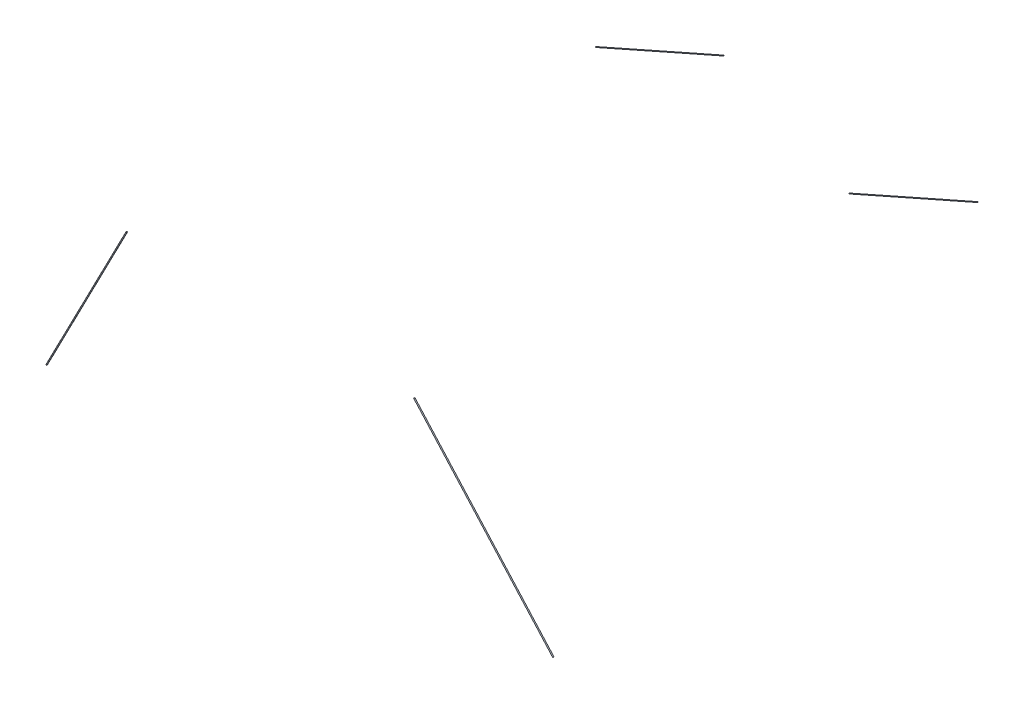
from build123d import *

# Parameters (mm, degrees)
SWEEP1_PROFILE_R = 0.79375
SWEEP2_PROFILE_R = 1.190625


with BuildPart() as part:
    # Sweep1: sweep along a curve in space
    with BuildLine() as sweep1_path:
        Line((285.474604576, 350.615166874, -782.773583612), (285.474604576, 189.720208784, -1071.122074957))
    # Sweep1 profile (on start of the path) → Sweep1 (sweep)
    with BuildSketch(Plane(origin=(285.474604576, 350.615166874, -782.773583612), x_dir=(0, -0.8732540622216938, 0.4872651668376371), z_dir=(0, -0.4872651668376371, -0.8732540622216938))):
        Circle(SWEEP1_PROFILE_R)
    sweep(path=sweep1_path.line)


with BuildPart() as body_2:
    # Sweep2: sweep along a curve in space
    with BuildLine() as sweep2_path:
        Line((323.50121122, 479.709448624, 234.199818078), (569.868046842, 64.810945847, 167.804447708))
    # Sweep2 profile (on start of the path) → Sweep2 (sweep)
    with BuildSketch(Plane(origin=(323.50121122, 479.709448624, 234.199818078), x_dir=(-0.8598357750897424, -0.5105707001736606, 0), z_dir=(0.5058049120396901, -0.8518098638247751, -0.13631341404036296))):
        Circle(SWEEP2_PROFILE_R)
    sweep(path=sweep2_path.line)


with BuildPart() as body_3:
    # Mirror1: mirrored copy
    add(part.part.mirror(Plane(origin=(0, 0, 0), x_dir=(0, 0, 1), z_dir=(1, 0, 0))))


with BuildPart() as body_4:
    # Mirror1 2: mirrored copy
    add(body_2.part.mirror(Plane(origin=(0, 0, 0), x_dir=(0, 0, 1), z_dir=(1, 0, 0))))


solid = Compound([part.part, body_2.part, body_3.part, body_4.part])
